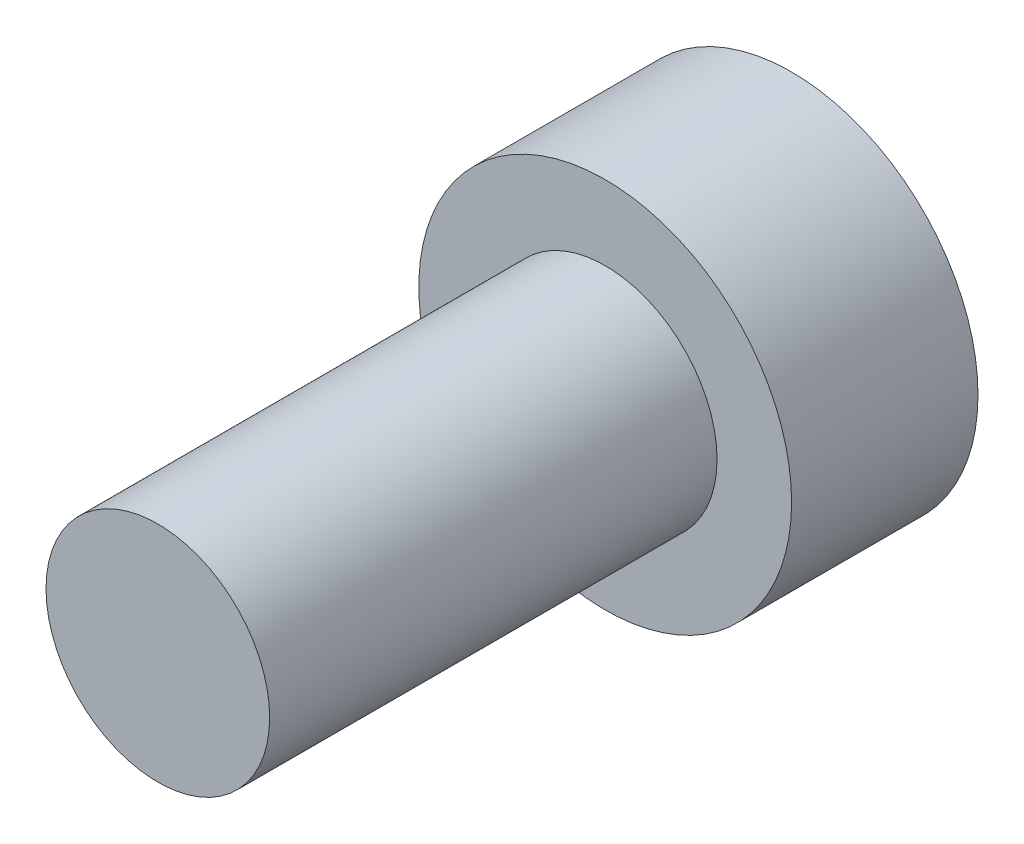
from build123d import *

# Parameters (mm, degrees)
SKETCH1_R           = 2.5
BOSS_EXTRUDE3_DEPTH = 2.5
SKETCH1_3_R         = 1.5
BOSS_EXTRUDE4_DEPTH = 6


with BuildPart() as part:
    # Sketch1 → Boss-Extrude3 (new body)
    with BuildSketch(Plane.XY):
        Circle(SKETCH1_R)
    extrude(amount=-BOSS_EXTRUDE3_DEPTH)

    # Sketch1<3> → Boss-Extrude4 (add)
    with BuildSketch(Plane.XY):
        Circle(SKETCH1_3_R)
    extrude(amount=BOSS_EXTRUDE4_DEPTH)


solid = part.part
